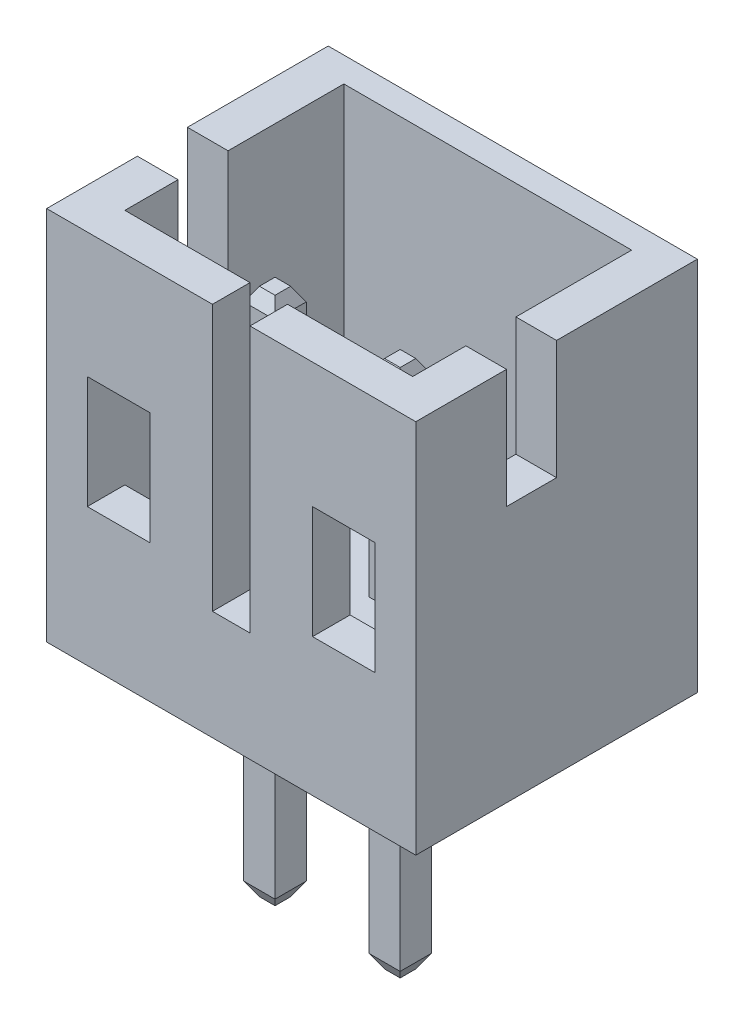
from build123d import *

# Parameters (mm, degrees)
SKETCH1_W            = 6
SKETCH1_H            = 4.1
BOSS_EXTRUDE1_DEPTH  = 2.6
SKETCH2_W            = 2.6
SKETCH2_H            = 3.5
CUT_EXTRUDE1_DEPTH   = 4.25
SKETCH3_W            = 0.6
SKETCH3_H            = 4.25
CUT_EXTRUDE2_DEPTH   = 1.6
SKETCH4_W            = 1
SKETCH4_H            = 0.6
BOSS_EXTRUDE2_DEPTH  = 4.25
BOSS_EXTRUDE3_DEPTH  = 1
SKETCH6_W            = 0.6
SKETCH6_H            = 2
BOSS_EXTRUDE4_DEPTH  = 1
SKETCH7_W            = 4.1
SKETCH7_H            = 6
BOSS_EXTRUDE5_DEPTH  = 0.65
SKETCH8_W            = 0.6
SKETCH8_H            = 2
BOSS_EXTRUDE6_DEPTH  = 1
BOSS_EXTRUDE7_DEPTH  = 1
SKETCH10_W           = 4.1
SKETCH10_H           = 6
BOSS_EXTRUDE8_DEPTH  = 0.65
SKETCH11_W           = 5.9
SKETCH11_H           = 6
BOSS_EXTRUDE9_DEPTH  = 0.4
SKETCH12_W           = 0.8
SKETCH12_H           = 1.9
CUT_EXTRUDE3_DEPTH   = 10.154916712
SKETCH13_W           = 0.8
SKETCH13_H           = 1.9
CUT_EXTRUDE4_DEPTH   = 10.54253635
SKETCH14_W           = 0.5
SKETCH14_H           = 0.5
BOSS_EXTRUDE10_DEPTH = 3.3
SKETCH15_W           = 0.5
SKETCH15_H           = 0.5
BOSS_EXTRUDE11_DEPTH = 3.3
SKETCH16_W           = 0.5
SKETCH16_H           = 0.5
BOSS_EXTRUDE12_DEPTH = 3.4
SKETCH17_W           = 0.5
SKETCH17_H           = 0.5
BOSS_EXTRUDE13_DEPTH = 3.4
CHAMFER1_SIZE        = 0.125
CHAMFER1_SIZE2       = 0.216506351
CHAMFER2_SIZE        = 0.125
CHAMFER2_SIZE2       = 0.216506351
CHAMFER3_SIZE        = 0.125
CHAMFER3_SIZE2       = 0.216506351
CHAMFER4_SIZE        = 0.125
CHAMFER4_SIZE2       = 0.216506351


with BuildPart() as part:
    # Sketch1 → Boss-Extrude1 (new body)
    with BuildSketch(Plane(origin=(4.6, 0, 0), x_dir=(0, -1, 0), z_dir=(-1, 0, 0))):
        with Locations((-3, 2.45)):
            Rectangle(SKETCH1_W, SKETCH1_H)
    extrude(amount=-BOSS_EXTRUDE1_DEPTH)

    # Sketch2 → Cut-Extrude1 (cut)
    with BuildSketch(Plane(origin=(0, 6, 0), x_dir=(-1, 0, 0), z_dir=(0, 1, 0))):
        with Locations((-5.9, 2.15)):
            Rectangle(SKETCH2_W, SKETCH2_H)
    extrude(amount=-CUT_EXTRUDE1_DEPTH, mode=Mode.SUBTRACT)

    # Sketch3 → Cut-Extrude2 (cut)
    with BuildSketch(Plane.ZY.offset(-4.6)):
        with Locations((4.2, 3.875)):
            Rectangle(SKETCH3_W, SKETCH3_H)
    extrude(amount=-CUT_EXTRUDE2_DEPTH, mode=Mode.SUBTRACT)

    # Sketch4 → Boss-Extrude2 (add)
    with BuildSketch(Plane(origin=(0, 1.75, 0), x_dir=(-1, 0, 0), z_dir=(0, 1, 0))):
        with Locations((-5.1, 4.2)):
            Rectangle(SKETCH4_W, SKETCH4_H)
    extrude(amount=BOSS_EXTRUDE2_DEPTH)

    # Sketch5 → Boss-Extrude3 (add)
    with BuildSketch(Plane.ZY.offset(-4.6)):
        Polygon((0.4, 0), (0.4, 1.75), (3.9, 1.75), (3.9, 2.2), (4.5, 2.2), (4.5, 0), align=None)
    extrude(amount=BOSS_EXTRUDE3_DEPTH)

    # Sketch6 → Boss-Extrude4 (add)
    with BuildSketch(Plane.ZY.offset(-4.6)):
        with Locations((4.2, 5)):
            Rectangle(SKETCH6_W, SKETCH6_H)
    extrude(amount=BOSS_EXTRUDE4_DEPTH)

    # Sketch7 → Boss-Extrude5 (add)
    with BuildSketch(Plane.ZY.offset(-3.6)):
        with Locations((2.45, 3)):
            Rectangle(SKETCH7_W, SKETCH7_H)
    extrude(amount=BOSS_EXTRUDE5_DEPTH)

    # Sketch8 → Boss-Extrude6 (add)
    with BuildSketch(Plane(origin=(7.2, 0, 0), x_dir=(0, 0, -1), z_dir=(1, 0, 0))):
        with Locations((-4.2, 5)):
            Rectangle(SKETCH8_W, SKETCH8_H)
    extrude(amount=BOSS_EXTRUDE6_DEPTH)

    # Sketch9 → Boss-Extrude7 (add)
    with BuildSketch(Plane(origin=(7.2, 0, 0), x_dir=(0, 0, -1), z_dir=(1, 0, 0))):
        Polygon((-3.9, 1.75), (-0.4, 1.75), (-0.4, 0), (-4.5, 0), (-4.5, 2.2), (-3.9, 2.2), align=None)
    extrude(amount=BOSS_EXTRUDE7_DEPTH)

    # Sketch10 → Boss-Extrude8 (add)
    with BuildSketch(Plane(origin=(8.2, 0, 0), x_dir=(0, 0, -1), z_dir=(1, 0, 0))):
        with Locations((-2.45, 3)):
            Rectangle(SKETCH10_W, SKETCH10_H)
    extrude(amount=BOSS_EXTRUDE8_DEPTH)

    # Sketch11 → Boss-Extrude9 (add)
    with BuildSketch(Plane(origin=(0, 0, 0.4), x_dir=(-1, 0, 0), z_dir=(0, 0, -1))):
        with Locations((-5.9, 3)):
            Rectangle(SKETCH11_W, SKETCH11_H)
    extrude(amount=BOSS_EXTRUDE9_DEPTH)

    # Sketch12 → Cut-Extrude3 (cut, through all)
    with BuildSketch(Plane(origin=(3.6, 0, 0), x_dir=(0, 0, -1), z_dir=(1, 0, 0))):
        with Locations((-2.65, 5.05)):
            Rectangle(SKETCH12_W, SKETCH12_H)
    extrude(amount=-CUT_EXTRUDE3_DEPTH, mode=Mode.SUBTRACT)

    # Sketch13 → Cut-Extrude4 (cut, through all)
    with BuildSketch(Plane(origin=(8.85, 0, 0), x_dir=(0, 0, -1), z_dir=(1, 0, 0))):
        with Locations((-2.65, 5.05)):
            Rectangle(SKETCH13_W, SKETCH13_H)
    extrude(amount=-CUT_EXTRUDE4_DEPTH, mode=Mode.SUBTRACT)


with BuildPart() as body_2:
    # Sketch14 → Boss-Extrude10 (new body)
    with BuildSketch(Plane(origin=(0, 1.75, 0), x_dir=(-1, 0, 0), z_dir=(0, 1, 0))):
        with Locations((-4.9, 2.8)):
            Rectangle(SKETCH14_W, SKETCH14_H)
    extrude(amount=BOSS_EXTRUDE10_DEPTH)

    # Chamfer1
    chamfer1_edges = [body_2.edges().sort_by_distance(p)[0] for p in [
        (5.15, 5.05, 2.8),
        (4.9, 5.05, 2.55),
        (4.65, 5.05, 2.8),
        (4.9, 5.05, 3.05),
    ]]
    chamfer1_side = [body_2.faces().sort_by_distance(p)[0] for p in [
        (4.9, 5.05, 2.8),
    ]]
    chamfer(chamfer1_edges, length=CHAMFER1_SIZE, length2=CHAMFER1_SIZE2, reference=chamfer1_side[0])


with BuildPart() as body_3:
    # Sketch15 → Boss-Extrude11 (new body)
    with BuildSketch(Plane(origin=(0, 1.75, 0), x_dir=(-1, 0, 0), z_dir=(0, 1, 0))):
        with Locations((-6.9, 2.8)):
            Rectangle(SKETCH15_W, SKETCH15_H)
    extrude(amount=BOSS_EXTRUDE11_DEPTH)

    # Chamfer2
    chamfer2_edges = [body_3.edges().sort_by_distance(p)[0] for p in [
        (7.15, 5.05, 2.8),
        (6.9, 5.05, 2.55),
        (6.65, 5.05, 2.8),
        (6.9, 5.05, 3.05),
    ]]
    chamfer2_side = [body_3.faces().sort_by_distance(p)[0] for p in [
        (6.9, 5.05, 2.8),
    ]]
    chamfer(chamfer2_edges, length=CHAMFER2_SIZE, length2=CHAMFER2_SIZE2, reference=chamfer2_side[0])


with BuildPart() as body_4:
    # Sketch16 → Boss-Extrude12 (new body)
    with BuildSketch(Plane.XZ):
        with Locations((4.9, 2.8)):
            Rectangle(SKETCH16_W, SKETCH16_H)
    extrude(amount=BOSS_EXTRUDE12_DEPTH)

    # Chamfer4
    chamfer4_edges = [body_4.edges().sort_by_distance(p)[0] for p in [
        (4.9, -3.4, 2.55),
        (5.15, -3.4, 2.8),
        (4.9, -3.4, 3.05),
        (4.65, -3.4, 2.8),
    ]]
    chamfer4_side = [body_4.faces().sort_by_distance(p)[0] for p in [
        (4.9, -3.4, 2.8),
    ]]
    chamfer(chamfer4_edges, length=CHAMFER4_SIZE, length2=CHAMFER4_SIZE2, reference=chamfer4_side[0])


with BuildPart() as body_5:
    # Sketch17 → Boss-Extrude13 (new body)
    with BuildSketch(Plane.XZ):
        with Locations((6.9, 2.8)):
            Rectangle(SKETCH17_W, SKETCH17_H)
    extrude(amount=BOSS_EXTRUDE13_DEPTH)

    # Chamfer3
    chamfer3_edges = [body_5.edges().sort_by_distance(p)[0] for p in [
        (6.9, -3.4, 2.55),
        (7.15, -3.4, 2.8),
        (6.9, -3.4, 3.05),
        (6.65, -3.4, 2.8),
    ]]
    chamfer3_side = [body_5.faces().sort_by_distance(p)[0] for p in [
        (6.9, -3.4, 2.8),
    ]]
    chamfer(chamfer3_edges, length=CHAMFER3_SIZE, length2=CHAMFER3_SIZE2, reference=chamfer3_side[0])


solid = Compound([part.part, body_2.part, body_3.part, body_4.part, body_5.part])
